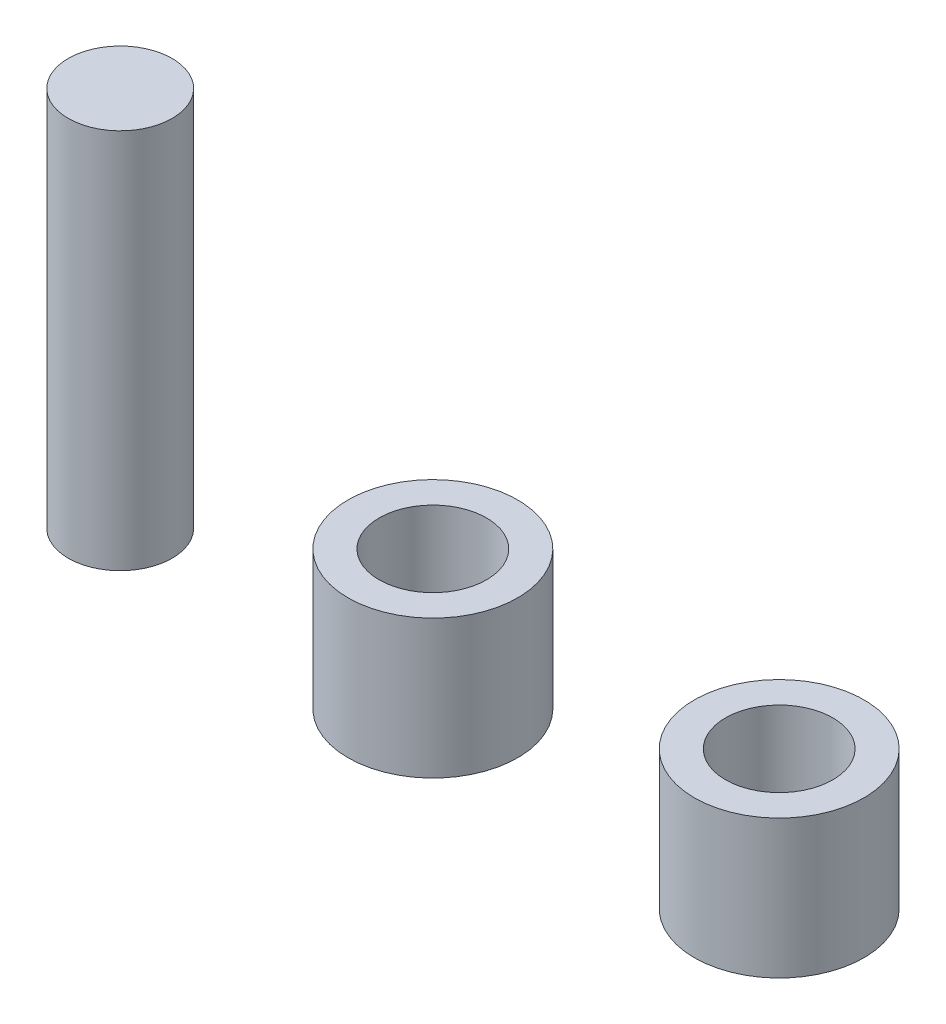
from build123d import *

# Parameters (mm, degrees)
SKETCH1_R           = 2.45
BOSS_EXTRUDE1_DEPTH = 4
SKETCH2_R           = 1.5
BOSS_EXTRUDE2_DEPTH = 11
SKETCH4_R           = 1.55
CUT_EXTRUDE1_DEPTH  = 3


with BuildPart() as part:
    # Sketch1 → Boss-Extrude1 (new body)
    with BuildSketch(Plane(origin=(0, 0, 0), x_dir=(1, 0, 0), z_dir=(0, 1, 0))):
        with Locations(Location((0, 0, 0), (0, 0, 270))):
            Circle(SKETCH1_R)
    extrude(amount=BOSS_EXTRUDE1_DEPTH)

    # Sketch4 → Cut-Extrude1 (cut)
    with BuildSketch(Plane(origin=(0, 4, 0), x_dir=(1, 0, 0), z_dir=(0, 1, 0))):
        with Locations(Location((0, 0, 0), (0, 0, 270))):
            Circle(SKETCH4_R)
    extrude(amount=-CUT_EXTRUDE1_DEPTH, mode=Mode.SUBTRACT)


with BuildPart() as body_2:
    # Sketch2 → Boss-Extrude2 (new body)
    with BuildSketch(Plane(origin=(0, 0, 0), x_dir=(1, 0, 0), z_dir=(0, 1, 0))):
        with Locations(Location((-9.027296586, 0, 0), (0, 0, 270))):
            Circle(SKETCH2_R)
    extrude(amount=BOSS_EXTRUDE2_DEPTH)


with BuildPart() as body_3:
    # Mirror1: mirrored copy
    add(part.part.mirror(Plane(origin=(5, 0, 0), x_dir=(0, 0, 1), z_dir=(1, 0, 0))))


solid = Compound([part.part, body_2.part, body_3.part])
